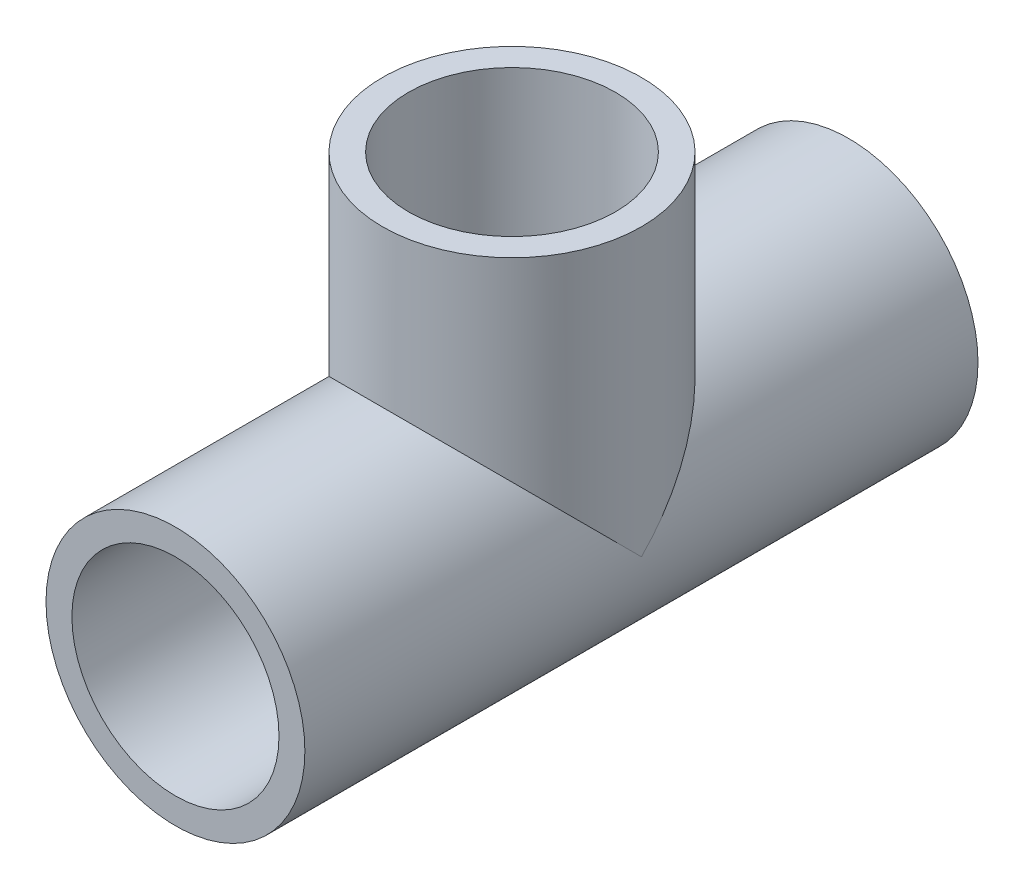
from build123d import *

# Parameters (mm, degrees)
SKETCH1_R           = 15.875
SKETCH1_R_2         = 12.7
BOSS_EXTRUDE1_DEPTH = 82.55
SKETCH2_R           = 15.875
SKETCH2_R_2         = 12.7
BOSS_EXTRUDE2_DEPTH = 35.052


with BuildPart() as part:
    # Sketch1 → Boss-Extrude1 (new body)
    with BuildSketch(Plane.XY):
        Circle(SKETCH1_R)
        Circle(SKETCH1_R_2, mode=Mode.SUBTRACT)
    extrude(amount=BOSS_EXTRUDE1_DEPTH)

    # Sketch2 → Boss-Extrude2 (add)
    with BuildSketch(Plane(origin=(0, 0, 0), x_dir=(1, 0, 0), z_dir=(0, 1, 0))):
        with Locations((0, -41.275)):
            Circle(SKETCH2_R)
        with Locations(Location((0, -41.275, 0), (0, 0, 90))):
            Circle(SKETCH2_R_2, mode=Mode.SUBTRACT)
    extrude(amount=BOSS_EXTRUDE2_DEPTH)


solid = part.part
